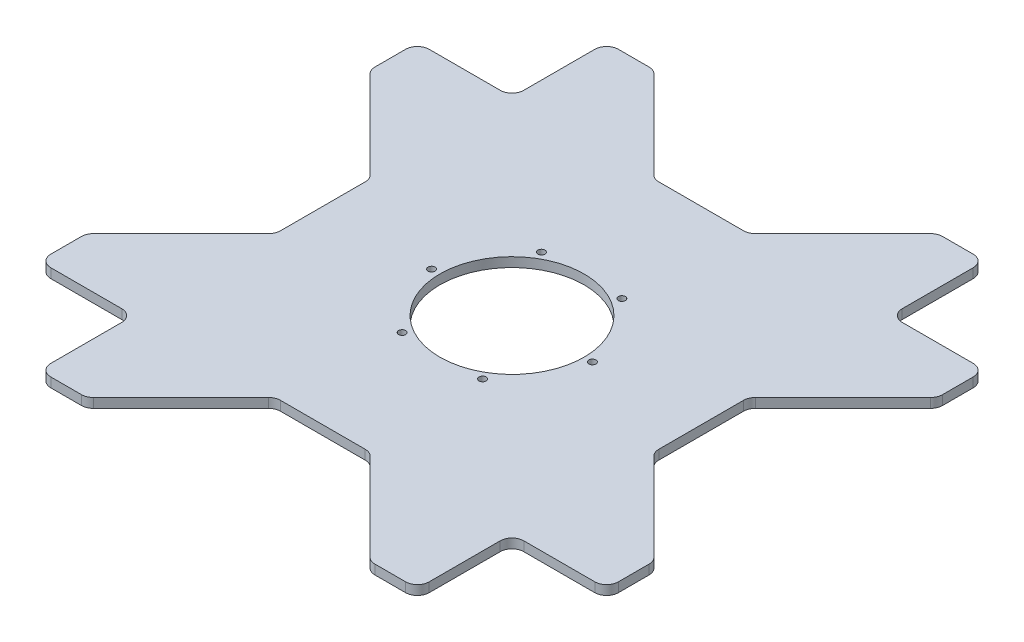
from build123d import *

# Parameters (mm, degrees)
SKETCH_1_W          = 160
SKETCH_1_H          = 160
EXTRUDE_1_DEPTH     = 4
EXTRUDE_2_DEPTH     = 4
FILLET_1_R          = 5
SKETCH_3_R          = 30.5
SKETCH_3_R_2        = 1.5
CUT_EXTRUDE_1_DEPTH = 10


with BuildPart() as part:
    # 草图1 → 凸台-拉伸1 (new body)
    with BuildSketch(Plane(origin=(0, 0, 0), x_dir=(1, 0, 0), z_dir=(0, 1, 0))):
        with Locations((80, 80)):
            Rectangle(SKETCH_1_W, SKETCH_1_H)
    extrude(amount=EXTRUDE_1_DEPTH)

    # 草图2 → 凸台-拉伸2 (add)
    with BuildSketch(Plane(origin=(0, 4, 0), x_dir=(1, 0, 0), z_dir=(0, 1, 0))):
        Polygon((0, 100), (-40, 140), (-40, 160), (0, 160), (0, 200), (20, 200), (60, 160), align=None)
        Polygon((60, 0), (0, 60), (-40, 20), (-40, 0), (0, 0), (0, -40), (20, -40), align=None)
        Polygon((160, 60), (200, 20), (200, 0), (160, 0), (160, -40), (140, -40), (100, 0), align=None)
        Polygon((100, 160), (160, 100), (200, 140), (200, 160), (160, 160), (160, 200), (140, 200), align=None)
    extrude(amount=-EXTRUDE_2_DEPTH)

    # 圆角1
    fillet_1_edges = [part.edges().sort_by_distance(p)[0] for p in [
        (160, 2, -100),
        (200, 2, -140),
        (200, 2, -160),
        (160, 2, -160),
        (160, 2, -200),
        (140, 2, -200),
        (100, 2, -160),
        (140, 2, 40),
        (160, 2, 40),
        (160, 2, 0),
        (200, 2, 0),
        (200, 2, -20),
        (160, 2, -60),
        (100, 2, 0),
        (0, 2, -60),
        (-40, 2, -20),
        (-40, 2, 0),
        (0, 2, 0),
        (0, 2, 40),
        (20, 2, 40),
        (60, 2, 0),
        (20, 2, -200),
        (0, 2, -200),
        (0, 2, -160),
        (-40, 2, -160),
        (-40, 2, -140),
        (0, 2, -100),
        (60, 2, -160),
    ]]
    fillet(fillet_1_edges, radius=FILLET_1_R)

    # 草图3 → 切除-拉伸1 (cut)
    with BuildSketch(Plane(origin=(0, 4, 0), x_dir=(1, 0, 0), z_dir=(0, 1, 0))):
        with Locations(Location((80, 80, 0), (0, 0, 270))):
            Circle(SKETCH_3_R)
        with Locations(Location((97, 109.444863729, 0), (0, 0, 270))):
            Circle(SKETCH_3_R_2)
        with Locations(Location((114, 80, 0), (0, 0, 270))):
            Circle(SKETCH_3_R_2)
        with Locations(Location((97, 50.555136271, 0), (0, 0, 270))):
            Circle(SKETCH_3_R_2)
        with Locations(Location((63, 50.555136271, 0), (0, 0, 270))):
            Circle(SKETCH_3_R_2)
        with Locations(Location((46, 80, 0), (0, 0, 270))):
            Circle(SKETCH_3_R_2)
        with Locations(Location((63, 109.444863729, 0), (0, 0, 270))):
            Circle(SKETCH_3_R_2)
    extrude(amount=-CUT_EXTRUDE_1_DEPTH, mode=Mode.SUBTRACT)


solid = part.part
